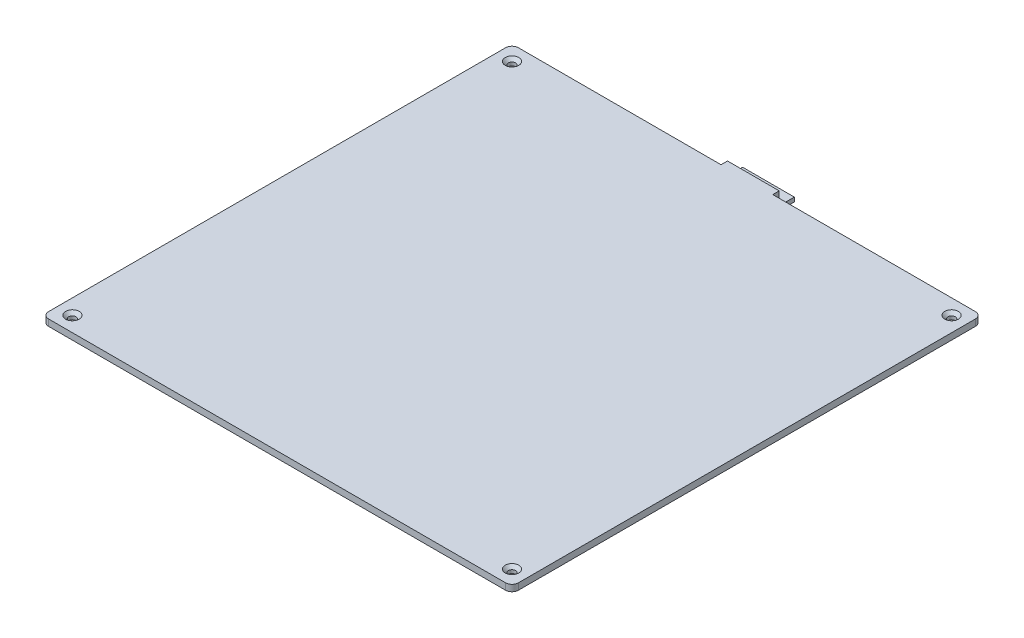
from build123d import *

# Parameters (mm, degrees)
BOSS_EXTRUDE1_DEPTH                            = 3
CSK_FOR_M3_FLAT_HEAD_MACHINE_SCREW1_AT_2_COUNT = 2
CSK_FOR_M3_FLAT_HEAD_MACHINE_SCREW1_AT_2_PITCH = 204
CSK_FOR_M3_FLAT_HEAD_MACHINE_SCREW1_AT_3_COUNT = 2
CSK_FOR_M3_FLAT_HEAD_MACHINE_SCREW1_AT_3_PITCH = 288.499566724
CSK_FOR_M3_FLAT_HEAD_MACHINE_SCREW1_AT_4_COUNT = 2
CSK_FOR_M3_FLAT_HEAD_MACHINE_SCREW1_AT_4_PITCH = 204
BOSS_EXTRUDE2_START                            = -3
BOSS_EXTRUDE2_DEPTH                            = 8
SKETCH6_W                                      = 24
SKETCH6_H                                      = 7
CUT_EXTRUDE1_DEPTH                             = 6


with BuildPart() as part:
    # Sketch1 → Boss-Extrude1 (new body)
    with BuildSketch(Plane(origin=(0, 0, 0), x_dir=(1, 0, 0), z_dir=(0, 1, 0))):
        with BuildLine():
            Line((-106, 109), (106, 109))
            ThreePointArc((106, 109), (108.121320344, 108.121320344), (109, 106))
            Line((109, 106), (109, -106))
            ThreePointArc((109, -106), (108.121320344, -108.121320344), (106, -109))
            Line((106, -109), (-106, -109))
            ThreePointArc((-106, -109), (-108.121320344, -108.121320344), (-109, -106))
            Line((-109, -106), (-109, 106))
            ThreePointArc((-109, 106), (-108.121320344, 108.121320344), (-106, 109))
        make_face()
    extrude(amount=BOSS_EXTRUDE1_DEPTH)

    # Sketch4 → CSK for M3 Flat Head Machine Screw1 (revolve, cut)
    with BuildSketch(Plane(origin=(-102, 3, -102), x_dir=(0, 0, 1), z_dir=(1, 0, 0))):
        Polygon((0, 0), (0, 3), (1.7, 3), (1.7, 1.45), (3.15, 0), align=None)
    csk_for_m3_flat_head_machine_screw1 = revolve(axis=Axis((-102, 9.35, -102), (0, -1, 0)), mode=Mode.SUBTRACT)

    # CSK for M3 Flat Head Machine Screw1 at 2: CSK for M3 Flat Head Machine Screw1 ×2
    with Locations(*[(0, 0, i * CSK_FOR_M3_FLAT_HEAD_MACHINE_SCREW1_AT_2_PITCH) for i in range(1, CSK_FOR_M3_FLAT_HEAD_MACHINE_SCREW1_AT_2_COUNT)]):
        add(csk_for_m3_flat_head_machine_screw1, mode=Mode.SUBTRACT)

    # CSK for M3 Flat Head Machine Screw1 at 3: CSK for M3 Flat Head Machine Screw1 ×2
    with Locations(*[Vector(0.7071067811865476, 0, 0.7071067811865475) * (i * CSK_FOR_M3_FLAT_HEAD_MACHINE_SCREW1_AT_3_PITCH) for i in range(1, CSK_FOR_M3_FLAT_HEAD_MACHINE_SCREW1_AT_3_COUNT)]):
        add(csk_for_m3_flat_head_machine_screw1, mode=Mode.SUBTRACT)

    # CSK for M3 Flat Head Machine Screw1 at 4: CSK for M3 Flat Head Machine Screw1 ×2
    with Locations(*[(i * CSK_FOR_M3_FLAT_HEAD_MACHINE_SCREW1_AT_4_PITCH, 0, 0) for i in range(1, CSK_FOR_M3_FLAT_HEAD_MACHINE_SCREW1_AT_4_COUNT)]):
        add(csk_for_m3_flat_head_machine_screw1, mode=Mode.SUBTRACT)

    # Sketch5 → Boss-Extrude2 (add)
    with BuildSketch(Plane(origin=(0, 0, 0), x_dir=(-1, 0, 0), z_dir=(0, -1, 0)).offset(BOSS_EXTRUDE2_START)):
        Polygon((0, 109), (12, 109), (12, 119), (-12, 119), (-12, 109), align=None)
    extrude(amount=BOSS_EXTRUDE2_DEPTH)

    # Sketch6 → Cut-Extrude1 (cut)
    with BuildSketch(Plane(origin=(0, 3, 0), x_dir=(1, 0, 0), z_dir=(0, 1, 0))):
        with Locations((0, 115.5)):
            Rectangle(SKETCH6_W, SKETCH6_H)
    extrude(amount=-CUT_EXTRUDE1_DEPTH, mode=Mode.SUBTRACT)


solid = part.part
